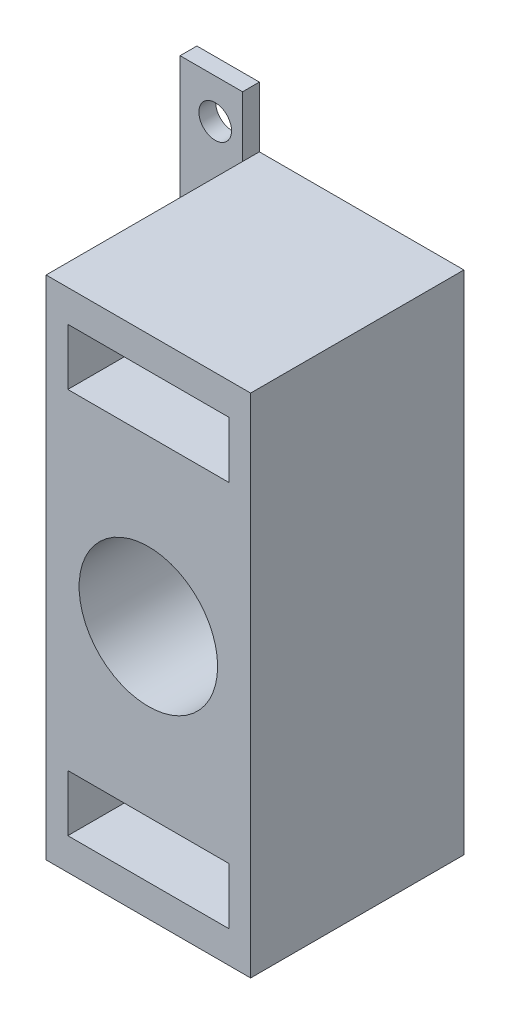
from build123d import *

# Parameters (mm, degrees)
SKETCH1_W           = 60.900023998
SKETCH1_H           = 150.828343314
SKETCH1_R           = 20.618232522
SKETCH1_W_2         = 47.971880286
SKETCH1_H_2         = 16.806586826
BOSS_EXTRUDE1_DEPTH = 63.5
SKETCH2_R           = 5.382285962
SKETCH2_R_2         = 4.862937902
BOSS_EXTRUDE2_DEPTH = 5


with BuildPart() as part:
    # Sketch1 → Boss-Extrude1 (new body)
    with BuildSketch(Plane.XY):
        Rectangle(SKETCH1_W, SKETCH1_H)
        Circle(SKETCH1_R, mode=Mode.SUBTRACT)
        with Locations((0, -57.530239521)):
            Rectangle(SKETCH1_W_2, SKETCH1_H_2, mode=Mode.SUBTRACT)
        with Locations((0, 57.530239521)):
            Rectangle(SKETCH1_W_2, SKETCH1_H_2, mode=Mode.SUBTRACT)
    extrude(amount=BOSS_EXTRUDE1_DEPTH)

    # Sketch2 → Boss-Extrude2 (add)
    with BuildSketch(Plane(origin=(0, 0, 0), x_dir=(-1, 0, 0), z_dir=(0, 0, -1))):
        Polygon((30.450011999, 93.405223195), (30.450011999, 75.414171657), (30.450011999, 0), (49.048404874, 0), (49.048404874, 93.405223195), align=None)
        with Locations((38.598962097, 34.973645215)):
            Circle(SKETCH2_R, mode=Mode.SUBTRACT)
        with Locations((38.598962097, 81.676256812)):
            Circle(SKETCH2_R_2, mode=Mode.SUBTRACT)
    extrude(amount=-BOSS_EXTRUDE2_DEPTH)


solid = part.part
